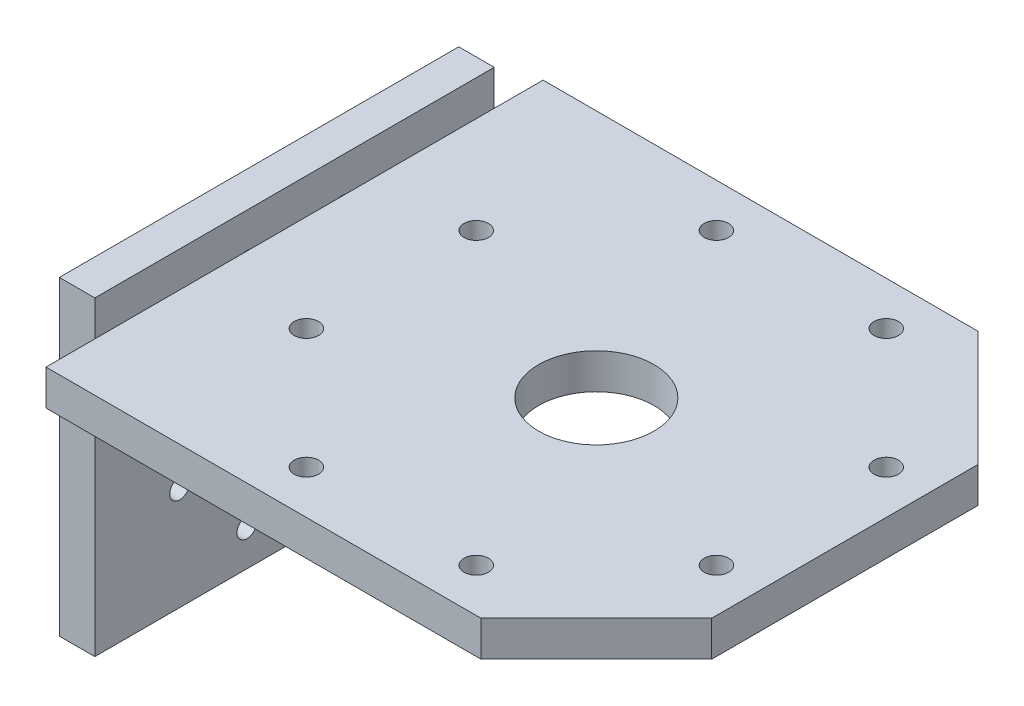
from build123d import *

# Parameters (mm, degrees)
SK_BACK_PLATE_W         = 90
SK_BACK_PLATE_H         = 70
SK_BACK_PLATE_R         = 2.25
SK_BACK_PLATE_R_2       = 6
BACK_PLATE_DEPTH        = 8
SK_ROLL_PILOT_RECESS_R  = 22.15
ROLL_PILOT_RECESS_DEPTH = 2.2
SK_MEDIAL_PLATE_R       = 2.75
SK_MEDIAL_PLATE_R_2     = 13
MEDIAL_PLATE_DEPTH      = 8


with BuildPart() as part:
    # SK_Back_Plate → Back_Plate (new body)
    with BuildSketch(Plane(origin=(-76, 0, 0), x_dir=(0, 0, -1), z_dir=(1, 0, 0))):
        with Locations((0, 1)):
            Rectangle(SK_BACK_PLATE_W, SK_BACK_PLATE_H)
        with Locations((25.86862691, -10.715136106)):
            Circle(SK_BACK_PLATE_R, mode=Mode.SUBTRACT)
        with Locations((10.715136106, -25.86862691)):
            Circle(SK_BACK_PLATE_R, mode=Mode.SUBTRACT)
        with Locations((-10.715136106, -25.86862691)):
            Circle(SK_BACK_PLATE_R, mode=Mode.SUBTRACT)
        with Locations((-25.86862691, -10.715136106)):
            Circle(SK_BACK_PLATE_R, mode=Mode.SUBTRACT)
        with Locations((-25.86862691, 10.715136106)):
            Circle(SK_BACK_PLATE_R, mode=Mode.SUBTRACT)
        with Locations((-10.715136106, 25.86862691)):
            Circle(SK_BACK_PLATE_R, mode=Mode.SUBTRACT)
        with Locations((10.715136106, 25.86862691)):
            Circle(SK_BACK_PLATE_R, mode=Mode.SUBTRACT)
        with Locations((25.86862691, 10.715136106)):
            Circle(SK_BACK_PLATE_R, mode=Mode.SUBTRACT)
        Circle(SK_BACK_PLATE_R_2, mode=Mode.SUBTRACT)
    extrude(amount=BACK_PLATE_DEPTH)

    # SK_Roll_Pilot_Recess → Roll_Pilot_Recess (cut)
    with BuildSketch(Plane(origin=(-76, 0, 0), x_dir=(0, 0, -1), z_dir=(1, 0, 0))):
        Circle(SK_ROLL_PILOT_RECESS_R)
    extrude(amount=ROLL_PILOT_RECESS_DEPTH, mode=Mode.SUBTRACT)

    # SK_Medial_Plate → Medial_Plate (add)
    with BuildSketch(Plane(origin=(0, 20, 0), x_dir=(1, 0, 0), z_dir=(0, 1, 0))):
        Polygon((-68, 56), (30, 56), (56, 30), (56, -30), (30, -56), (-68, -56), align=None)
        with Locations(Location((46.193976626, 19.134171618, 0), (0, 0, 270))):
            Circle(SK_MEDIAL_PLATE_R, mode=Mode.SUBTRACT)
        with Locations(Location((19.134171618, 46.193976626, 0), (0, 0, 270))):
            Circle(SK_MEDIAL_PLATE_R, mode=Mode.SUBTRACT)
        with Locations(Location((-19.134171618, 46.193976626, 0), (0, 0, 270))):
            Circle(SK_MEDIAL_PLATE_R, mode=Mode.SUBTRACT)
        with Locations(Location((-46.193976626, 19.134171618, 0), (0, 0, 270))):
            Circle(SK_MEDIAL_PLATE_R, mode=Mode.SUBTRACT)
        with Locations(Location((-46.193976626, -19.134171618, 0), (0, 0, 270))):
            Circle(SK_MEDIAL_PLATE_R, mode=Mode.SUBTRACT)
        with Locations(Location((-19.134171618, -46.193976626, 0), (0, 0, 270))):
            Circle(SK_MEDIAL_PLATE_R, mode=Mode.SUBTRACT)
        with Locations(Location((19.134171618, -46.193976626, 0), (0, 0, 270))):
            Circle(SK_MEDIAL_PLATE_R, mode=Mode.SUBTRACT)
        with Locations(Location((46.193976626, -19.134171618, 0), (0, 0, 270))):
            Circle(SK_MEDIAL_PLATE_R, mode=Mode.SUBTRACT)
        with Locations(Location((0, 0, 0), (0, 0, 270))):
            Circle(SK_MEDIAL_PLATE_R_2, mode=Mode.SUBTRACT)
    extrude(amount=MEDIAL_PLATE_DEPTH)


solid = part.part
